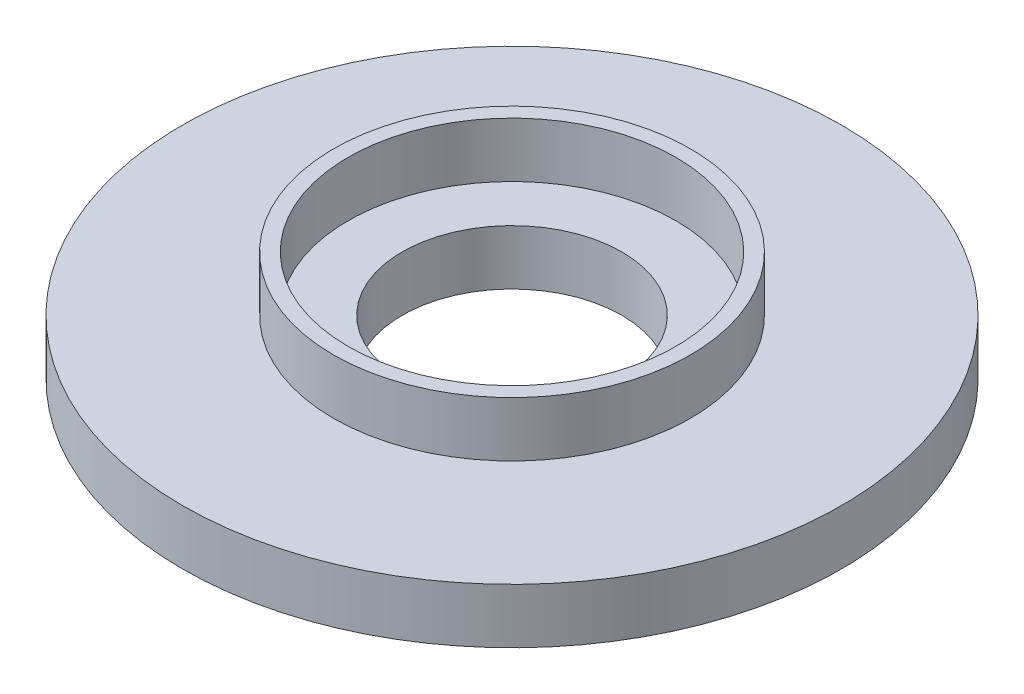
from build123d import *

# Parameters (mm, degrees)
SKETCH1_R           = 18
SKETCH1_R_2         = 6
BOSS_EXTRUDE1_DEPTH = 3
SKETCH2_R           = 9.75
SKETCH2_R_2         = 8.95
BOSS_EXTRUDE2_DEPTH = 3


with BuildPart() as part:
    # Sketch1 → Boss-Extrude1 (new body)
    with BuildSketch(Plane(origin=(0, 0, 0), x_dir=(1, 0, 0), z_dir=(0, 1, 0))):
        with Locations(Location((0, 0, 0), (0, 0, 270))):
            Circle(SKETCH1_R)
        with Locations(Location((0, 0, 0), (0, 0, 270))):
            Circle(SKETCH1_R_2, mode=Mode.SUBTRACT)
    extrude(amount=BOSS_EXTRUDE1_DEPTH)

    # Sketch2 → Boss-Extrude2 (add)
    with BuildSketch(Plane(origin=(0, 3, 0), x_dir=(1, 0, 0), z_dir=(0, 1, 0))):
        with Locations(Location((0, 0, 0), (0, 0, 270))):
            Circle(SKETCH2_R)
        with Locations(Location((0, 0, 0), (0, 0, 270))):
            Circle(SKETCH2_R_2, mode=Mode.SUBTRACT)
    extrude(amount=BOSS_EXTRUDE2_DEPTH)


solid = part.part
